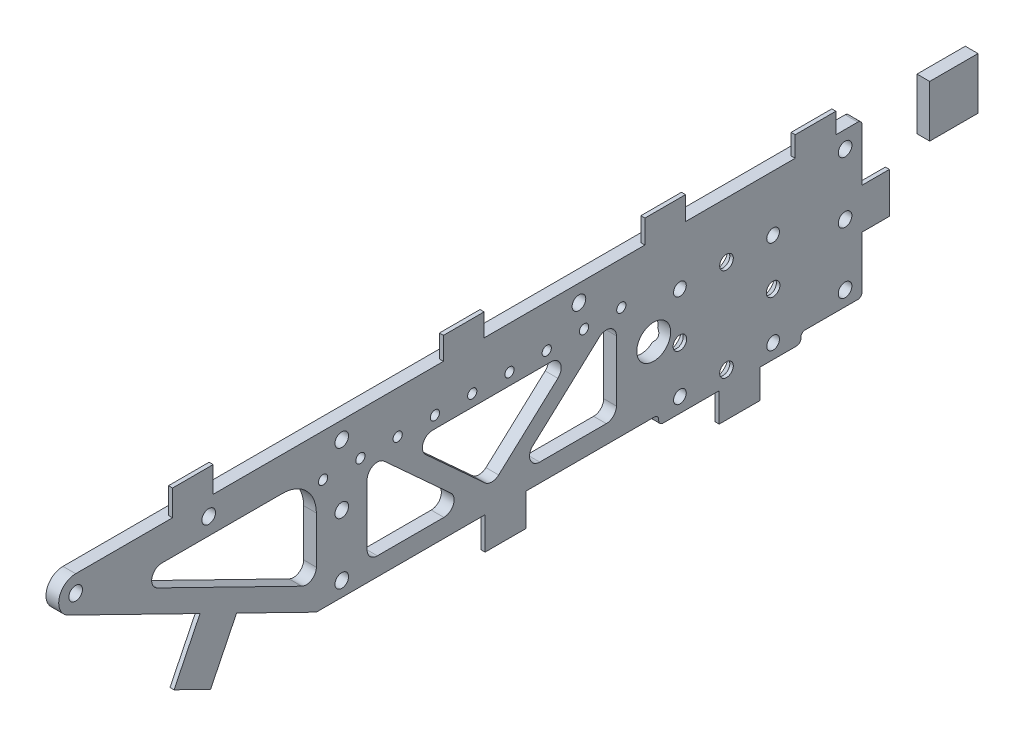
from build123d import *

# Parameters (mm, degrees)
SKETCH1_R                                   = 2.38125
SKETCH1_R_2                                 = 6.35
BOSS_EXTRUDE1_DEPTH                         = 4.7625
CSK_FOR_10_FLAT_HEAD_SOCKET_CAP_SCR_2_COUNT = 2
CSK_FOR_10_FLAT_HEAD_SOCKET_CAP_SCR_2_PITCH = 34.925
CSK_FOR_10_FLAT_HEAD_SOCKET_CAP_SCR_3_COUNT = 2
CSK_FOR_10_FLAT_HEAD_SOCKET_CAP_SCR_3_PITCH = 24.695704333
CSK_FOR_10_FLAT_HEAD_SOCKET_CAP_SCR_4_COUNT = 2
CSK_FOR_10_FLAT_HEAD_SOCKET_CAP_SCR_4_PITCH = 24.695704333
BOSS_EXTRUDE3_DEPTH                         = 4.7625
FILLET1_R                                   = 1.5875
FILLET2_R                                   = 12.7
F_10_CLEARANCE_HOLE1_D                      = 5.1054
CUT_EXTRUDE1_DEPTH                          = 405.635956407
FILLET3_R                                   = 3.81
F_8_32_TAPPED_HOLE1_D                       = 3.4544
SKETCH15_W                                  = 18.10213161
SKETCH15_H                                  = 19.392754731
BOSS_EXTRUDE4_DEPTH                         = 4.7625
SKETCH16_W                                  = 15.24
SKETCH16_H                                  = 7.651701492
SKETCH16_H_2                                = 8.755812057
SKETCH16_H_3                                = 8.440654528
SKETCH16_H_4                                = 9.654294012
SKETCH16_H_5                                = 12.147349998
SKETCH16_H_6                                = 10.838514334
SKETCH16_W_2                                = 10.262772518
SKETCH16_H_7                                = 15.24
BOSS_EXTRUDE5_DEPTH                         = 1.524


with BuildPart() as part:
    # Sketch1 → Boss-Extrude1 (new body)
    with BuildSketch(Plane(origin=(0, 0, 0), x_dir=(0, 0, -1), z_dir=(1, 0, 0))):
        with BuildLine():
            Line((399.161, 66.167), (399.161, 8.5725))
            Line((399.161, 8.5725), (376.2375, 8.5725))
            Line((376.2375, 8.5725), (376.2375, 4.953))
            Line((376.2375, 4.953), (322.961, 4.953))
            Line((322.961, 4.953), (322.961, 8.5725))
            Line((322.961, 8.5725), (194.6275, 8.5725))
            Line((194.6275, 8.5725), (194.6275, 53.467))
            Line((194.6275, 53.467), (104.4067, 53.467))
            ThreePointArc((104.4067, 53.467), (98.0567, 59.817), (104.4067, 66.167))
            Line((104.4067, 66.167), (399.161, 66.167))
        make_face()
        with Locations(Location((330.8985, 45.339, 0), (0, 0, 180))):
            Circle(SKETCH1_R, mode=Mode.SUBTRACT)
        with Locations(Location((365.8235, 45.339, 0), (0, 0, 180))):
            Circle(SKETCH1_R, mode=Mode.SUBTRACT)
        with Locations(Location((330.8985, 10.414, 0), (0, 0, 180))):
            Circle(SKETCH1_R, mode=Mode.SUBTRACT)
        with Locations(Location((365.8235, 10.414, 0), (0, 0, 180))):
            Circle(SKETCH1_R, mode=Mode.SUBTRACT)
        with Locations(Location((321.075626239, 33.140191614, 0), (0, 0, 180))):
            Circle(SKETCH1_R_2, mode=Mode.SUBTRACT)
    extrude(amount=BOSS_EXTRUDE1_DEPTH)

    # Sketch3 → CSK for #10 Flat Head Socket Cap Screw1 (revolve, cut)
    with BuildSketch(Plane(origin=(0, 10.414, -348.361), x_dir=(0, 0, 1), z_dir=(0, 1, 0))):
        Polygon((0, 0), (0, 4.7625), (2.5527, 4.7625), (2.5527, 3.449038355), (5.5509033, 0), align=None)
    csk_for_10_flat_head_socket_cap_screw1 = revolve(axis=Axis((-6.35, 10.414, -348.361), (1, 0, 0)), mode=Mode.SUBTRACT)

    # CSK for _10 Flat Head Socket Cap Scr 2: CSK for #10 Flat Head Socket Cap Screw1 ×2
    with Locations(*[(0, i * CSK_FOR_10_FLAT_HEAD_SOCKET_CAP_SCR_2_PITCH, 0) for i in range(1, CSK_FOR_10_FLAT_HEAD_SOCKET_CAP_SCR_2_COUNT)]):
        add(csk_for_10_flat_head_socket_cap_screw1, mode=Mode.SUBTRACT)

    # CSK for _10 Flat Head Socket Cap Scr 3: CSK for #10 Flat Head Socket Cap Screw1 ×2
    with Locations(*[Vector(0, 0.7071067811865483, 0.7071067811865468) * (i * CSK_FOR_10_FLAT_HEAD_SOCKET_CAP_SCR_3_PITCH) for i in range(1, CSK_FOR_10_FLAT_HEAD_SOCKET_CAP_SCR_3_COUNT)]):
        add(csk_for_10_flat_head_socket_cap_screw1, mode=Mode.SUBTRACT)

    # CSK for _10 Flat Head Socket Cap Scr 4: CSK for #10 Flat Head Socket Cap Screw1 ×2
    with Locations(*[Vector(0, 0.7071067811865482, -0.7071067811865468) * (i * CSK_FOR_10_FLAT_HEAD_SOCKET_CAP_SCR_4_PITCH) for i in range(1, CSK_FOR_10_FLAT_HEAD_SOCKET_CAP_SCR_4_COUNT)]):
        add(csk_for_10_flat_head_socket_cap_screw1, mode=Mode.SUBTRACT)

    # Sketch13 → Boss-Extrude3 (add)
    with BuildSketch(Plane.ZY):
        Polygon((-194.6275, 8.5725), (-101.614335682, 54.113912983), (-120.263908272, 53.467), (-194.6275, 17.056852397), align=None)
    extrude(amount=-BOSS_EXTRUDE3_DEPTH)

    # Fillet1
    fillet1_edges = [part.edges().sort_by_distance(p)[0] for p in [
        (2.38125, 66.167, -399.161),
        (2.38125, 8.5725, -399.161),
        (2.38125, 8.5725, -376.2375),
        (2.38125, 4.953, -376.2375),
        (2.38125, 4.953, -322.961),
        (2.38125, 8.5725, -322.961),
        (2.38125, 8.5725, -194.6275),
    ]]
    fillet(fillet1_edges, radius=FILLET1_R)

    # Fillet2
    fillet2_edges = [part.edges().sort_by_distance(p)[0] for p in [
        (2.38125, 53.467, -194.6275),
    ]]
    fillet(fillet2_edges, radius=FILLET2_R)

    # #10 Clearance Hole1 (through all)
    with Locations(Plane(origin=(4.7625, 0, 0), x_dir=(0, 0, -1), z_dir=(1, 0, 0))):
        with Locations((204.1525, 59.817), (204.1525, 36.957), (204.1525, 14.097), (154.2796, 59.817), (392.811, 59.817), (392.811, 36.957), (392.811, 14.097), (293.0525, 59.817), (104.4067, 59.817)):
            Hole(F_10_CLEARANCE_HOLE1_D / 2)

    # Sketch14 → Cut-Extrude1 (cut, through all)
    with BuildSketch(Plane.ZY):
        Polygon((-292.404060808, 45.847), (-260.391563119, 16.591138705), (-228.379065431, 45.847), align=None)
        with BuildLine():
            Line((-220.05776247, 44.849445703), (-252.248711211, 15.4305))
            Line((-252.248711211, 15.4305), (-213.6775, 15.4305))
            Line((-213.6775, 15.4305), (-213.6775, 42.037))
            ThreePointArc((-213.6775, 42.037), (-214.793423164, 44.731076836), (-217.4875, 45.847))
            ThreePointArc((-217.4875, 45.847), (-218.86602854, 45.588866983), (-220.05776247, 44.849445703))
        make_face()
        with BuildLine():
            Line((-307.105626239, 42.037), (-307.105626239, 15.4305))
            Line((-307.105626239, 15.4305), (-268.534415028, 15.4305))
            Line((-268.534415028, 15.4305), (-300.725363768, 44.849445703))
            ThreePointArc((-300.725363768, 44.849445703), (-301.917097699, 45.588866983), (-303.295626239, 45.847))
            ThreePointArc((-303.295626239, 45.847), (-305.989703075, 44.731076836), (-307.105626239, 42.037))
        make_face()
    extrude(amount=-CUT_EXTRUDE1_DEPTH, mode=Mode.SUBTRACT)

    # Fillet3
    fillet3_edges = [part.edges().sort_by_distance(p)[0] for p in [
        (2.38125, 15.4305, -268.534415028),
        (2.38125, 15.4305, -307.105626239),
        (2.38125, 15.4305, -213.6775),
        (2.38125, 15.4305, -252.248711211),
        (2.38125, 16.591138705, -260.391563119),
        (2.38125, 45.847, -292.404060808),
        (2.38125, 45.847, -228.379065431),
        (2.38125, 17.056852397, -194.6275),
        (2.38125, 53.467, -120.263908272),
    ]]
    fillet(fillet3_edges, radius=FILLET3_R)

    # #8-32 Tapped Hole1 (through all)
    with Locations(Plane(origin=(4.7625, 0, 0), x_dir=(0, 0, -1), z_dir=(1, 0, 0))):
        with Locations((197.1675, 50.292), (211.1375, 50.292), (225.1075, 50.292), (239.0775, 50.292), (253.0475, 50.292), (267.0175, 50.292), (280.9875, 50.292), (294.9575, 50.292), (308.9275, 50.292)):
            Hole(F_8_32_TAPPED_HOLE1_D / 2)

    # Sketch16 → Boss-Extrude5 (add)
    with BuildSketch(Plane.ZY.offset(-4.7625)):
        with Locations((-381.721893004, 69.992850746)):
            Rectangle(SKETCH16_W, SKETCH16_H)
        with Locations((-325.392449665, 70.544906029)):
            Rectangle(SKETCH16_W, SKETCH16_H_2)
        with Locations((-249.884035056, 70.387327264)):
            Rectangle(SKETCH16_W, SKETCH16_H_3)
        with Locations((-148.3299064, 70.994147006)):
            Rectangle(SKETCH16_W, SKETCH16_H_4)
        Polygon((-151.033600761, 29.917089052), (-164.7210096, 23.21541469), (-154.983882123, 3.328437571), (-141.296473284, 10.030111933), align=None)
        with Locations((-265.496187265, 2.498825001)):
            Rectangle(SKETCH16_W, SKETCH16_H_5)
        with Locations((-353.240188147, -0.466257167)):
            Rectangle(SKETCH16_W, SKETCH16_H_6)
        with Locations((-404.292386259, 37.276549646)):
            Rectangle(SKETCH16_W_2, SKETCH16_H_7)
    extrude(amount=BOSS_EXTRUDE5_DEPTH)


with BuildPart() as body_2:
    # Sketch15 → Boss-Extrude4 (new body)
    with BuildSketch(Plane(origin=(4.7625, 0, 0), x_dir=(0, 0, -1), z_dir=(1, 0, 0))):
        with Locations((433.575362003, 56.210087935)):
            Rectangle(SKETCH15_W, SKETCH15_H)
    extrude(amount=-BOSS_EXTRUDE4_DEPTH)


solid = Compound([part.part, body_2.part])
